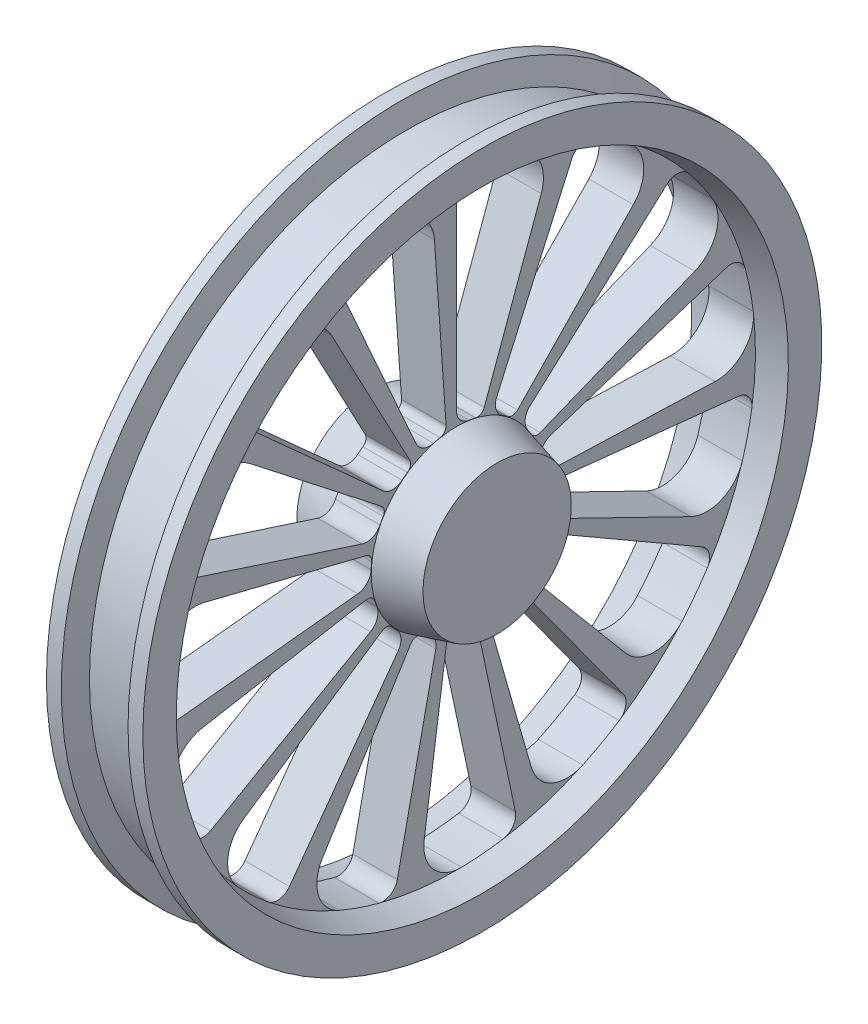
from build123d import *

# Parameters (mm, degrees)
CUT_EXTRUDE1_DEPTH      = 658.143439441
CUT_EXTRUDE1_DEPTH_BACK = 658.143439441


with BuildPart() as part:
    # Sketch1 → Revolve1 (revolve)
    with BuildSketch(Plane(origin=(0, 0, 0), x_dir=(1, 0, 0), z_dir=(0, 1, 0)), mode=Mode.PRIVATE) as revolve1_sk:
        Polygon((0, 0), (0, 100), (55, 114.737205584), (55, 403.121778265), (20, 412.5), (20, 457.5), (40, 457.5), (48.038475773, 427.5), (121.961524227, 427.5), (130, 457.5), (150, 457.5), (150, 412.5), (115, 403.121778265), (115, 114.737205584), (170, 100), (170, 0), align=None)
    revolve(revolve1_sk.sketch.rotate(Axis((0, 0, 0), (1, 0, 0)), 180), axis=Axis((0, 0, 0), (1, 0, 0)))

    # Sketch2 → Cut-Extrude1 (cut, two sides: drawn at the far end of the back side and taken through both)
    with BuildSketch(Plane(origin=(115, 0, 0), x_dir=(0, 0, -1), z_dir=(1, 0, 0)).offset(-CUT_EXTRUDE1_DEPTH_BACK)):
        with BuildLine():
            Line((114.40382391, 329.525077711), (37.54906865, 118.368373055))
            ThreePointArc((37.54906865, 118.368373055), (32.922530006, 112.9997519), (25.899971046, 112.045488529))
            ThreePointArc((25.899971046, 112.045488529), (21.485038965, 112.975187987), (17.037037037, 113.730995639))
            ThreePointArc((17.037037037, 113.730995639), (4.846464781, 120.45769909), (0, 133.510299228))
            Line((0, 133.510299228), (0, 382.599394904))
            ThreePointArc((0, 382.599394904), (6.231940753, 397.105963918), (21.044054457, 402.57212507))
            ThreePointArc((21.044054457, 402.57212507), (49.12480154, 400.117385257), (76.965360372, 395.70633229))
            ThreePointArc((76.965360372, 395.70633229), (110.938411732, 371.244728011), (114.40382391, 329.525077711))
        make_face()
        with BuildLine():
            Line((238.543017588, 254.50391063), (82.447535806, 92.8623074))
            ThreePointArc((82.447535806, 92.8623074), (76.037367497, 89.839610727), (69.233806779, 91.824179816))
            ThreePointArc((69.233806779, 91.824179816), (65.578708467, 94.469217187), (61.822671177, 96.968847207))
            ThreePointArc((61.822671177, 96.968847207), (53.422026047, 108.072349026), (54.303530924, 121.967727408))
            Line((54.303530924, 121.967727408), (155.617193526, 349.521939311))
            ThreePointArc((155.617193526, 349.521939311), (167.210707876, 360.239590879), (182.965535106, 359.208548165))
            ThreePointArc((182.965535106, 359.208548165), (207.62014142, 345.544562955), (231.259620603, 330.191090113))
            ThreePointArc((231.259620603, 330.191090113), (252.346116547, 294.026217772), (238.543017588, 254.50391063))
        make_face()
        with BuildLine():
            Line((321.435956429, 135.476705306), (113.09007501, 51.299505168))
            ThreePointArc((113.09007501, 51.299505168), (106.004653371, 51.145384692), (100.59648835, 55.725636216))
            ThreePointArc((100.59648835, 55.725636216), (98.33322351, 59.628660509), (95.918603829, 63.439904158))
            ThreePointArc((95.918603829, 63.439904158), (92.760433685, 77.000308009), (99.217488019, 89.335827478))
            Line((99.217488019, 89.335827478), (284.326760554, 256.008965105))
            ThreePointArc((284.326760554, 256.008965105), (299.277224547, 261.084519902), (313.250612546, 253.734549975))
            ThreePointArc((313.250612546, 253.734549975), (330.216072679, 231.223946545), (345.566991504, 207.582808764))
            ThreePointArc((345.566991504, 207.582808764), (350.120885318, 165.967903336), (321.435956429, 135.476705306))
        make_face()
        with BuildLine():
            Line((348.74969825, -6.975653133), (124.178312853, 0.866552451))
            ThreePointArc((124.178312853, 0.866552451), (117.642771654, 3.607657002), (114.565123195, 9.991623863))
            ThreePointArc((114.565123195, 9.991623863), (114.08503088, 14.47776672), (113.429338485, 18.941625347))
            ThreePointArc((113.429338485, 18.941625347), (116.059719637, 32.614214211), (126.975840073, 41.256951386))
            Line((126.975840073, 41.256951386), (363.873647654, 118.229715063))
            ThreePointArc((363.873647654, 118.229715063), (379.595990245, 116.785563556), (389.371813284, 104.387542988))
            ThreePointArc((389.371813284, 104.387542988), (395.714645053, 76.922609173), (400.122690197, 49.081573949))
            ThreePointArc((400.122690197, 49.081573949), (387.356572269, 9.212230642), (348.74969825, -6.975653133))
        make_face()
        with BuildLine():
            Line((315.761448952, -148.221857774), (113.79499228, -49.716235058))
            ThreePointArc((113.79499228, -49.716235058), (108.939385968, -44.553867358), (108.724407448, -37.470031027))
            ThreePointArc((108.724407448, -37.470031027), (110.11049998, -33.176464461), (111.327110045, -28.831832566))
            ThreePointArc((111.327110045, -28.831832566), (119.291225695, -17.411173515), (132.77891584, -13.955626409))
            Line((132.77891584, -13.955626409), (380.503475387, -39.992526796))
            ThreePointArc((380.503475387, -39.992526796), (394.279160708, -47.706677692), (398.167090174, -63.009018512))
            ThreePointArc((398.167090174, -63.009018512), (392.790560342, -90.679346145), (385.493540754, -117.906310894))
            ThreePointArc((385.493540754, -117.906310894), (357.614788851, -149.13632042), (315.761448952, -148.221857774))
        make_face()
        with BuildLine():
            Line((228.175176527, -263.839156652), (83.735483746, -91.702633867))
            ThreePointArc((83.735483746, -91.702633867), (81.399390764, -85.011623292), (84.084253923, -78.452777148))
            ThreePointArc((84.084253923, -78.452777148), (87.096863311, -75.094183539), (89.975412902, -71.620004699))
            ThreePointArc((89.975412902, -71.620004699), (101.896195103, -64.426011164), (115.623310798, -66.755149614))
            Line((115.623310798, -66.755149614), (331.340795459, -191.299697452))
            ThreePointArc((331.340795459, -191.299697452), (340.787882371, -203.950000966), (338.115659938, -219.510748293))
            ThreePointArc((338.115659938, -219.510748293), (321.949419358, -242.602018718), (304.209056016, -264.507123438))
            ThreePointArc((304.209056016, -264.507123438), (266.038159612, -281.697846821), (228.175176527, -263.839156652))
        make_face()
        with BuildLine():
            Line((101.135343175, -333.836268441), (39.197349359, -117.832814188))
            ThreePointArc((39.197349359, -117.832814188), (39.784701407, -110.770097253), (44.905169013, -105.870325379))
            ThreePointArc((44.905169013, -105.870325379), (49.023387726, -104.027436073), (53.066149468, -102.024427372))
            ThreePointArc((53.066149468, -102.024427372), (66.88238668, -100.301006191), (78.475384915, -108.012101))
            Line((78.475384915, -108.012101), (224.886281861, -309.529412515))
            ThreePointArc((224.886281861, -309.529412515), (228.371283212, -324.928516245), (219.600960414, -338.057075501))
            ThreePointArc((219.600960414, -338.057075501), (195.440298949, -352.576598285), (170.32406184, -365.372251368))
            ThreePointArc((170.32406184, -365.372251368), (128.461115696, -365.551256362), (101.135343175, -333.836268441))
        make_face()
        with BuildLine():
            Line((-43.391709799, -346.11005661), (-12.118362828, -123.588630458))
            ThreePointArc((-12.118362828, -123.588630458), (-8.709124256, -117.375415084), (-2.038427569, -114.98193255))
            ThreePointArc((-2.038427569, -114.98193255), (2.473323039, -114.97339985), (6.9812667, -114.78789969))
            ThreePointArc((6.9812667, -114.78789969), (20.304005992, -118.833046042), (27.758352054, -130.592778863))
            Line((27.758352054, -130.592778863), (79.5468871, -374.238680168))
            ThreePointArc((79.5468871, -374.238680168), (76.467214497, -389.723939183), (63.115259823, -398.150263203))
            ThreePointArc((63.115259823, -398.150263203), (35.137775331, -401.587480951), (6.988490026, -403.061197734))
            ThreePointArc((6.988490026, -403.061197734), (-31.328022157, -386.197532748), (-43.391709799, -346.11005661))
        make_face()
        with BuildLine():
            Line((-180.415941946, -298.53827168), (-61.338699991, -107.974849755))
            ThreePointArc((-61.338699991, -107.974849755), (-55.697063215, -103.685457325), (-48.629561507, -104.212119006))
            ThreePointArc((-48.629561507, -104.212119006), (-44.50440167, -106.039418293), (-40.310740503, -107.703501336))
            ThreePointArc((-40.310740503, -107.703501336), (-29.785121787, -116.817772668), (-27.758352054, -130.592778863))
            Line((-27.758352054, -130.592778863), (-79.5468871, -374.238680168))
            ThreePointArc((-79.5468871, -374.238680168), (-88.658730287, -387.132552505), (-104.283642576, -389.399653316))
            ThreePointArc((-104.283642576, -389.399653316), (-131.240388858, -381.160239852), (-157.555455201, -371.057201315))
            ThreePointArc((-157.555455201, -371.057201315), (-185.700260373, -340.066747229), (-180.415941946, -298.53827168))
        make_face()
        with BuildLine():
            Line((-286.244618704, -199.346507441), (-99.95301868, -73.691236609))
            ThreePointArc((-99.95301868, -73.691236609), (-93.054473952, -72.067342042), (-86.812202474, -75.423083348))
            ThreePointArc((-86.812202474, -75.423083348), (-83.786911021, -78.770257975), (-80.632654462, -81.996189146))
            ThreePointArc((-80.632654462, -81.996189146), (-74.724131421, -94.603645143), (-78.475384915, -108.012101))
            Line((-78.475384915, -108.012101), (-224.886281861, -309.529412515))
            ThreePointArc((-224.886281861, -309.529412515), (-238.454775165, -317.60243051), (-253.650955786, -313.318305785))
            ThreePointArc((-253.650955786, -313.318305785), (-274.925897531, -294.826930551), (-294.856630878, -274.89404384))
            ThreePointArc((-294.856630878, -274.89404384), (-307.963236536, -235.135331704), (-286.244618704, -199.346507441))
        make_face()
        with BuildLine():
            Line((-342.579000437, -65.685921059), (-121.284552395, -26.665739189))
            ThreePointArc((-121.284552395, -26.665739189), (-114.32192077, -27.988128608), (-109.984224969, -33.592711381))
            ThreePointArc((-109.984224969, -33.592711381), (-108.581902277, -37.881004448), (-107.012449939, -42.11099094))
            ThreePointArc((-107.012449939, -42.11099094), (-106.742659884, -56.031687926), (-115.623310798, -66.755149614))
            Line((-115.623310798, -66.755149614), (-331.340795459, -191.299697452))
            ThreePointArc((-331.340795459, -191.299697452), (-347.019823124, -193.155962952), (-359.159714395, -183.061376777))
            ThreePointArc((-359.159714395, -183.061376777), (-371.074220899, -157.515366539), (-381.174416387, -131.199208852))
            ThreePointArc((-381.174416387, -131.199208852), (-376.976571344, -89.54688119), (-342.579000437, -65.685921059))
        make_face()
        with BuildLine():
            Line((-339.678360762, 79.332357811), (-121.644885166, 24.970506788))
            ThreePointArc((-121.644885166, 24.970506788), (-115.822068905, 20.930486526), (-114.138975792, 14.046145563))
            ThreePointArc((-114.138975792, 14.046145563), (-114.602096193, 9.558218886), (-114.888820645, 5.055580166))
            ThreePointArc((-114.888820645, 5.055580166), (-120.304412726, -7.771342835), (-132.77891584, -13.955626409))
            Line((-132.77891584, -13.955626409), (-380.503475387, -39.992526796))
            ThreePointArc((-380.503475387, -39.992526796), (-395.581991088, -35.311074633), (-402.56649552, -21.151472664))
            ThreePointArc((-402.56649552, -21.151472664), (-403.060440369, 7.03203533), (-401.583682443, 35.181161255))
            ThreePointArc((-401.583682443, 35.181161255), (-380.807232242, 71.52503859), (-339.678360762, 79.332357811))
        make_face()
        with BuildLine():
            Line((-278.04424663, 210.633351304), (-100.971712182, 72.289125291))
            ThreePointArc((-100.971712182, 72.289125291), (-97.295529115, 66.230030393), (-98.55806078, 59.256296334))
            ThreePointArc((-98.55806078, 59.256296334), (-100.806546549, 55.344739341), (-102.899870529, 51.347995532))
            ThreePointArc((-102.899870529, 51.347995532), (-113.064439677, 41.832738033), (-126.975840073, 41.256951386))
            Line((-126.975840073, 41.256951386), (-363.873647654, 118.229715063))
            ThreePointArc((-363.873647654, 118.229715063), (-375.744439044, 128.63941928), (-376.365872369, 144.415713228))
            ThreePointArc((-376.365872369, 144.415713228), (-365.353848011, 170.363534406), (-352.555481531, 195.47838897))
            ThreePointArc((-352.555481531, 195.47838897), (-318.792863161, 220.229629413), (-278.04424663, 210.633351304))
        make_face()
        with BuildLine():
            Line((-168.333756304, 305.513924813), (-62.839612863, 107.108297305))
            ThreePointArc((-62.839612863, 107.108297305), (-61.945708439, 100.077800323), (-65.935561688, 94.220495143))
            ThreePointArc((-65.935561688, 94.220495143), (-69.580629209, 91.561651573), (-73.118597982, 88.761875989))
            ThreePointArc((-73.118597982, 88.761875989), (-86.27459785, 84.203558457), (-99.217488019, 89.335827478))
            Line((-99.217488019, 89.335827478), (-284.326760554, 256.008965105))
            ThreePointArc((-284.326760554, 256.008965105), (-290.937259957, 270.346988948), (-285.088170709, 285.012110328))
            ThreePointArc((-285.088170709, 285.012110328), (-264.474256196, 304.237630679), (-242.567234996, 321.975627366))
            ThreePointArc((-242.567234996, 321.975627366), (-201.656311896, 330.854516587), (-168.333756304, 305.513924813))
        make_face()
        with BuildLine():
            Line((-29.516830248, 347.568365215), (-13.841973599, 123.407471666))
            ThreePointArc((-13.841973599, 123.407471666), (-15.884912015, 116.6212094), (-21.912204974, 112.893114375))
            ThreePointArc((-21.912204974, 112.893114375), (-26.323588959, 111.946722437), (-30.694455583, 110.828021711))
            ThreePointArc((-30.694455583, 110.828021711), (-44.567094274, 112.014818658), (-54.303530924, 121.967727408))
            Line((-54.303530924, 121.967727408), (-155.617193526, 349.521939311))
            ThreePointArc((-155.617193526, 349.521939311), (-155.824385542, 365.309108202), (-144.516134388, 376.327324298))
            ThreePointArc((-144.516134388, 376.327324298), (-117.864662811, 385.506276696), (-90.636909876, 392.800354735))
            ThreePointArc((-90.636909876, 392.800354735), (-49.651552315, 384.271652124), (-29.516830248, 347.568365215))
        make_face()
    extrude(amount=CUT_EXTRUDE1_DEPTH + CUT_EXTRUDE1_DEPTH_BACK, mode=Mode.SUBTRACT)


solid = part.part
